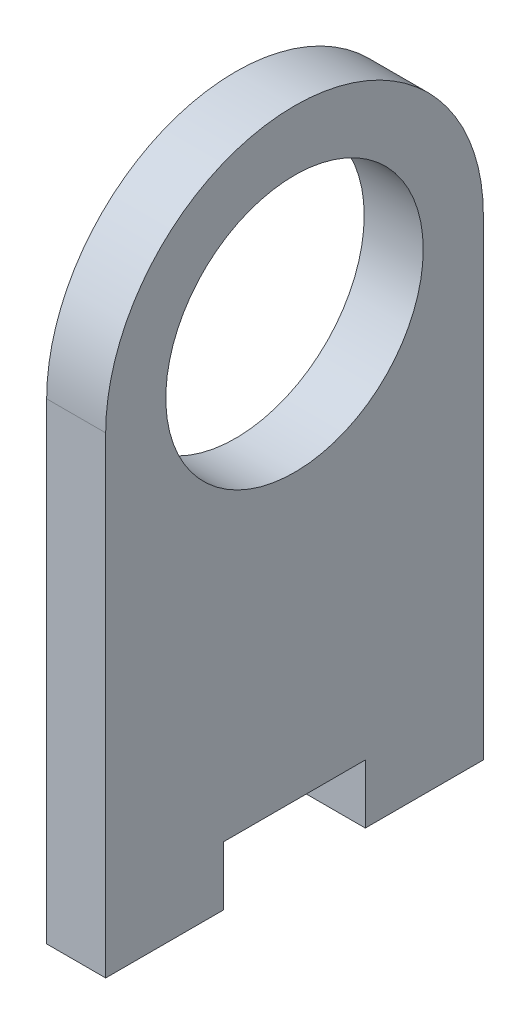
from build123d import *

# Parameters (mm, degrees)
SKETCH1_R           = 13.85
BOSS_EXTRUDE1_DEPTH = 6.35


with BuildPart() as part:
    # Sketch1 → Boss-Extrude1 (new body)
    with BuildSketch(Plane(origin=(0, 0, 0), x_dir=(0, 0, -1), z_dir=(1, 0, 0))):
        with BuildLine():
            Line((27.94, 0), (40.64, 0))
            Line((40.64, 0), (40.64, 50.8))
            ThreePointArc((40.64, 50.8), (20.32, 71.12), (0, 50.8))
            Line((0, 50.8), (0, 0))
            Line((0, 0), (12.7, 0))
            Line((12.7, 0), (12.7, 6.35))
            Line((12.7, 6.35), (27.94, 6.35))
            Line((27.94, 6.35), (27.94, 0))
        make_face()
        with Locations((20.32, 50.8)):
            Circle(SKETCH1_R, mode=Mode.SUBTRACT)
    extrude(amount=BOSS_EXTRUDE1_DEPTH)


solid = part.part
